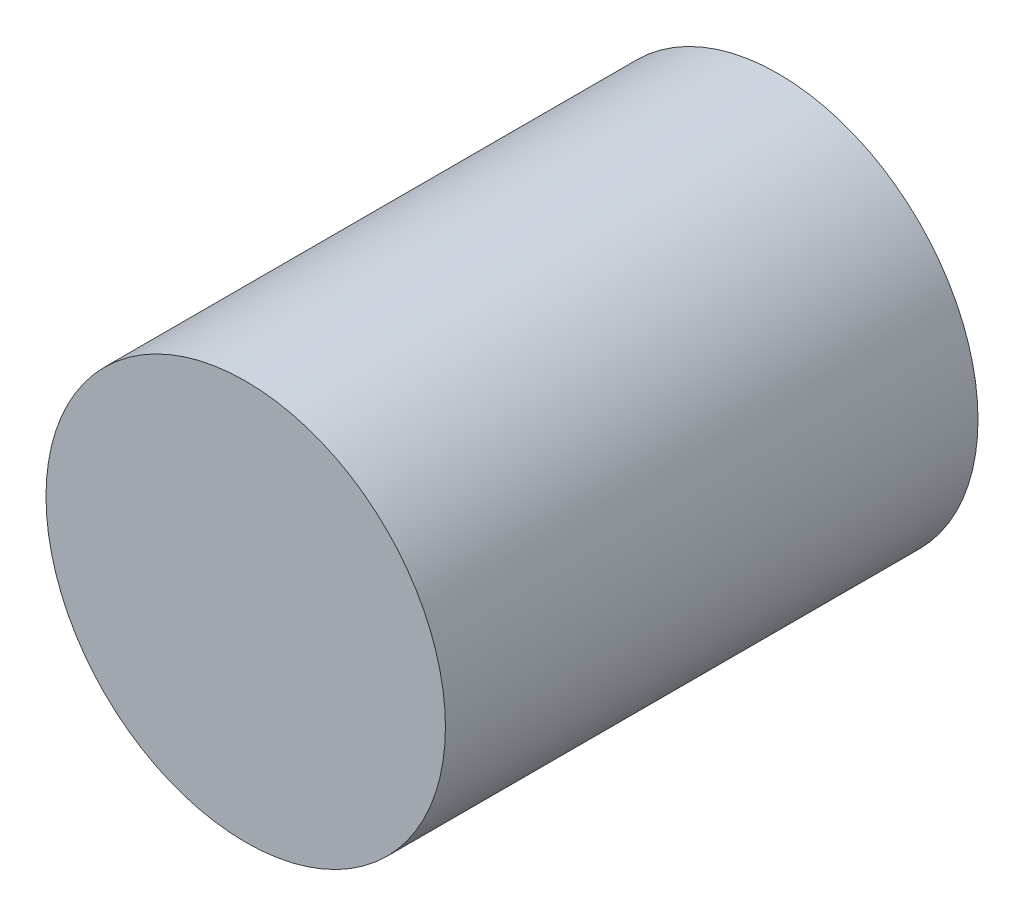
from build123d import *

# Parameters (mm, degrees)
SKETCH_1_R      = 7.5
EXTRUDE_1_DEPTH = 20


with BuildPart() as part:
    # 草图1 → 凸台-拉伸1 (new body)
    with BuildSketch(Plane.XY):
        with Locations((-25, -30)):
            Circle(SKETCH_1_R)
    extrude(amount=EXTRUDE_1_DEPTH)


solid = part.part
